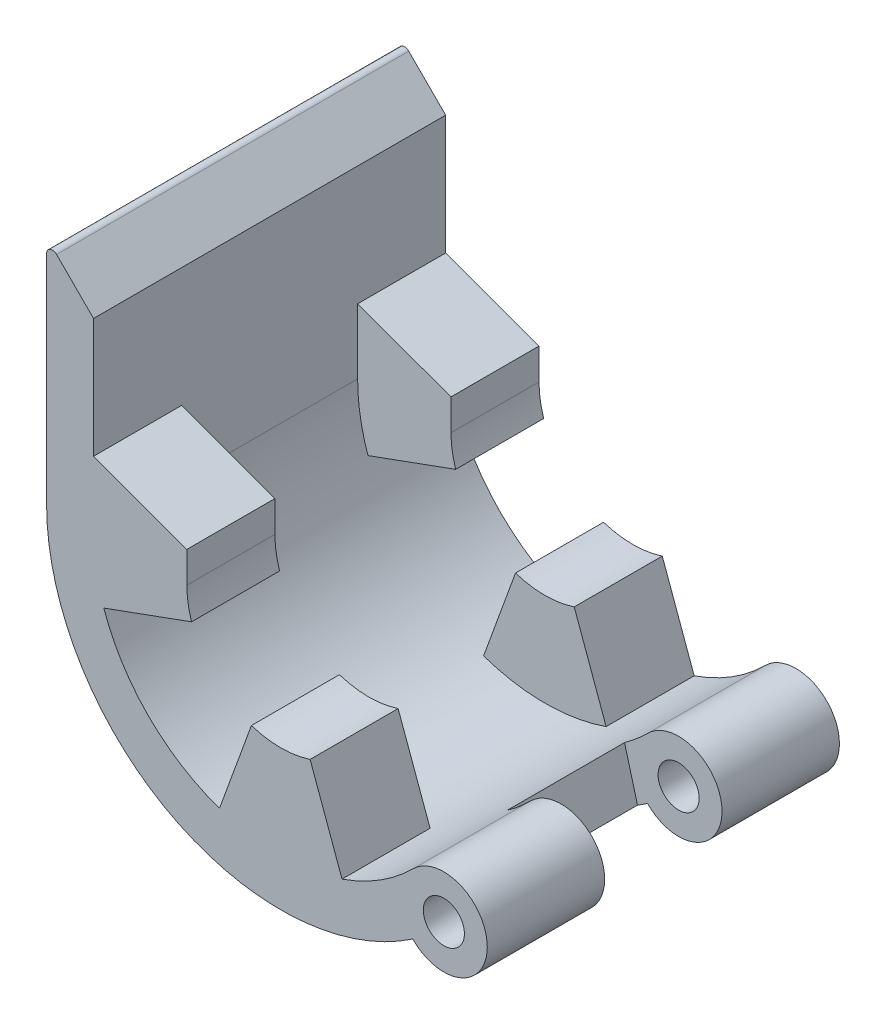
from build123d import *

# Parameters (mm, degrees)
SKETCH_1_R          = 1.75
EXTRUDE_1_DEPTH     = 15
EXTRUDE_START       = 15
EXTRUDE_2_DEPTH     = 7.5
EXTRUDE_START_2     = -7.5
EXTRUDE_3_DEPTH     = 7.5
SKETCH_1_5_R        = 1.75
CUT_EXTRUDE_2_DEPTH = 5


with BuildPart() as part:
    # Эскиз1 → Бобышка-Вытянуть1 (new, symmetric)
    with BuildSketch(Plane.XY):
        with BuildLine():
            Line((-15.95, 15.707106781), (-15.95, 0))
            ThreePointArc((-15.95, 0), (-6.103800746, -14.735878544), (11.27835316, -11.27835316))
            ThreePointArc((11.27835316, -11.27835316), (17.594576586, -13.917676686), (11.245989359, -16.478174151))
            ThreePointArc((11.245989359, -16.478174151), (-9.317859526, -17.640294608), (-19.95, 0))
            Line((-19.95, 0), (-19.95, 18.5))
            ThreePointArc((-19.95, 18.5), (-19.641341716, 18.961939766), (-19.096446609, 18.853553391))
            Line((-19.096446609, 18.853553391), (-15.95, 15.707106781))
        make_face()
        with Locations((13.89464825, -13.89464825)):
            Circle(SKETCH_1_R, mode=Mode.SUBTRACT)
    extrude(amount=EXTRUDE_1_DEPTH, both=True)

    # Эскиз1<3> → Бобышка-Вытянуть2 (add)
    with BuildSketch(Plane.XY.offset(EXTRUDE_START)):
        with BuildLine():
            ThreePointArc((-7.599342077, -2.5), (-7.899200485, -1.265950905), (-8, 0))
            Line((-8, 0), (-8, 2.645827558))
            Line((-8, 2.645827558), (-15.95, 5.539390921))
            Line((-15.95, 5.539390921), (-15.95, 0))
            ThreePointArc((-15.95, 0), (-15.728899355, -2.646549654), (-15.071727264, -5.219725787))
            Line((-15.071727264, -5.219725787), (-7.599342077, -2.5))
        make_face()
        with BuildLine():
            Line((-2.5, -7.599342077), (-5.219725787, -15.071727264))
            ThreePointArc((-5.219725787, -15.071727264), (0, -15.95), (5.219725787, -15.071727264))
            Line((5.219725787, -15.071727264), (2.5, -7.599342077))
            ThreePointArc((2.5, -7.599342077), (0, -8), (-2.5, -7.599342077))
        make_face()
    extrude(amount=-EXTRUDE_2_DEPTH)

    # Эскиз1<4> → Бобышка-Вытянуть3 (add)
    with BuildSketch(Plane.XY.offset(EXTRUDE_START_2)):
        with BuildLine():
            ThreePointArc((-7.599342077, -2.5), (-7.899200485, -1.265950905), (-8, 0))
            Line((-8, 0), (-8, 2.645827558))
            Line((-8, 2.645827558), (-15.95, 5.539390921))
            Line((-15.95, 5.539390921), (-15.95, 0))
            ThreePointArc((-15.95, 0), (-15.728899355, -2.646549654), (-15.071727264, -5.219725787))
            Line((-15.071727264, -5.219725787), (-7.599342077, -2.5))
        make_face()
        with BuildLine():
            Line((-2.5, -7.599342077), (-5.219725787, -15.071727264))
            ThreePointArc((-5.219725787, -15.071727264), (0, -15.95), (5.219725787, -15.071727264))
            Line((5.219725787, -15.071727264), (2.5, -7.599342077))
            ThreePointArc((2.5, -7.599342077), (0, -8), (-2.5, -7.599342077))
        make_face()
    extrude(amount=-EXTRUDE_3_DEPTH)

    # Эскиз1<5> → Вырез-Вытянуть2 (cut, symmetric)
    with BuildSketch(Plane.XY):
        with BuildLine():
            ThreePointArc((11.27835316, -11.27835316), (10.318427509, -12.162752721), (9.289403961, -12.965703762))
            Line((9.289403961, -12.965703762), (10.394358671, -17.028206242))
            ThreePointArc((10.394358671, -17.028206242), (10.823668488, -16.758600791), (11.245989359, -16.478174151))
            ThreePointArc((11.245989359, -16.478174151), (17.594576586, -13.917676686), (11.27835316, -11.27835316))
        make_face()
        with Locations((13.89464825, -13.89464825)):
            Circle(SKETCH_1_5_R, mode=Mode.SUBTRACT)
    extrude(amount=CUT_EXTRUDE_2_DEPTH, both=True, mode=Mode.SUBTRACT)


solid = part.part
